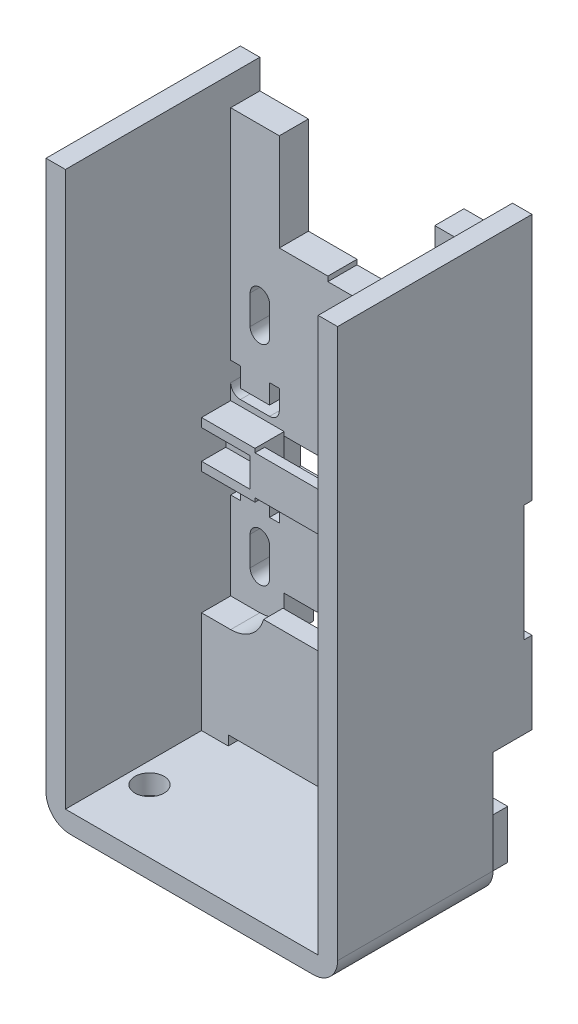
from build123d import *

# Parameters (mm, degrees)
BOSS_EXTRUDE1_DEPTH = 20
CUT_EXTRUDE1_DEPTH  = 39.668462602
CUT_EXTRUDE2_DEPTH  = 39.668462602
SKETCH4_W           = 26
SKETCH4_H           = 57
CUT_EXTRUDE3_DEPTH  = 14
CUT_EXTRUDE4_DEPTH  = 0.8
CUT_EXTRUDE5_DEPTH  = 39.260815464
CUT_EXTRUDE6_DEPTH  = 4
SKETCH8_W           = 5
SKETCH8_H           = 6.5
BOSS_EXTRUDE2_DEPTH = 1
SKETCH9_W           = 20.5
SKETCH9_H           = 1
CUT_EXTRUDE7_DEPTH  = 39.668462602
SKETCH10_W          = 11.5
SKETCH10_H          = 2
CUT_EXTRUDE8_DEPTH  = 1
CUT_EXTRUDE9_DEPTH  = 3
CUT_EXTRUDE10_REACH = 40.668
SKETCH12_W          = 15
SKETCH12_H          = 2
SKETCH13_W          = 16
SKETCH13_H          = 4
CUT_EXTRUDE11_DEPTH = 2.2
SKETCH14_W          = 5
SKETCH14_H          = 3
CUT_EXTRUDE12_DEPTH = 2.5
CUT_EXTRUDE13_REACH = 66.078
SKETCH15_R          = 1.5


with BuildPart() as part:
    # Sketch1 → Boss-Extrude1 (new body)
    with BuildSketch(Plane.XY):
        with BuildLine():
            Line((-15, 29.5), (15, 29.5))
            Line((15, 29.5), (15, -27))
            ThreePointArc((15, -27), (14.267766953, -28.767766953), (12.5, -29.5))
            Line((12.5, -29.5), (-12.5, -29.5))
            ThreePointArc((-12.5, -29.5), (-14.267766953, -28.767766953), (-15, -27))
            Line((-15, -27), (-15, 29.5))
        make_face()
    extrude(amount=BOSS_EXTRUDE1_DEPTH)

    # Sketch2 → Cut-Extrude1 (cut, through all)
    with BuildSketch(Plane(origin=(0, 0, 0), x_dir=(-1, 0, 0), z_dir=(0, 0, -1))):
        Polygon((-13, 29.5), (-13, 26.5), (-8, 26.5), (-8, 16.5), (-3, 16.5), (-3, 16), (3, 16), (3, 16.5), (8, 16.5), (8, 26.5), (13, 26.5), (13, 29.5), align=None)
    extrude(amount=-CUT_EXTRUDE1_DEPTH, mode=Mode.SUBTRACT)

    # Sketch3 → Cut-Extrude2 (cut, through all)
    with BuildSketch(Plane(origin=(0, 0, 0), x_dir=(-1, 0, 0), z_dir=(0, 0, -1))):
        with BuildLine():
            Line((-9, 11), (-9, 8))
            ThreePointArc((-9, 8), (-10, 7), (-11, 8))
            Line((-11, 8), (-11, 11))
            ThreePointArc((-11, 11), (-10, 12), (-9, 11))
        make_face()
        with BuildLine():
            Line((9, 8), (9, 11))
            ThreePointArc((9, 11), (10, 12), (11, 11))
            Line((11, 11), (11, 8))
            ThreePointArc((11, 8), (10, 7), (9, 8))
        make_face()
        with BuildLine():
            Line((9, -13.5), (9, -10.5))
            ThreePointArc((9, -10.5), (10, -9.5), (11, -10.5))
            Line((11, -10.5), (11, -13.5))
            ThreePointArc((11, -13.5), (10, -14.5), (9, -13.5))
        make_face()
        with BuildLine():
            Line((-9, -10.5), (-9, -13.5))
            ThreePointArc((-9, -13.5), (-10, -14.5), (-11, -13.5))
            Line((-11, -13.5), (-11, -10.5))
            ThreePointArc((-11, -10.5), (-10, -9.5), (-9, -10.5))
        make_face()
    extrude(amount=-CUT_EXTRUDE2_DEPTH, mode=Mode.SUBTRACT)

    # Sketch4 → Cut-Extrude3 (cut)
    with BuildSketch(Plane.XY.offset(20)):
        with Locations((0, 1)):
            Rectangle(SKETCH4_W, SKETCH4_H)
    extrude(amount=-CUT_EXTRUDE3_DEPTH, mode=Mode.SUBTRACT)

    # Sketch5 → Cut-Extrude4 (cut)
    with BuildSketch(Plane(origin=(0, 0, 0), x_dir=(-1, 0, 0), z_dir=(0, 0, -1))):
        Polygon((-15, 4), (-12, 4), (-12, 2), (-9, 2), (-9, 4), (9, 4), (9, 2), (12, 2), (12, 4), (15, 4), (15, -8), (12, -8), (12, -6), (9, -6), (9, -8), (5.5, -8), (5.5, -14), (-5.5, -14), (-5.5, -8), (-9, -8), (-9, -6), (-12, -6), (-12, -8), (-15, -8), align=None)
    extrude(amount=-CUT_EXTRUDE4_DEPTH, mode=Mode.SUBTRACT)

    # Sketch6 → Cut-Extrude5 (cut, through all)
    with BuildSketch(Plane(origin=(0, 0, 0.8), x_dir=(-1, 0, 0), z_dir=(0, 0, -1))):
        with BuildLine():
            Line((-12, 4), (-12, 2))
            Line((-12, 2), (-9, 2))
            Line((-9, 2), (-9, 4))
            Line((-9, 4), (-8, 4))
            Line((-8, 4), (-8, 2))
            ThreePointArc((-8, 2), (-8.292893219, 1.292893219), (-9, 1))
            Line((-9, 1), (-12, 1))
            ThreePointArc((-12, 1), (-12.707106781, 1.292893219), (-13, 2))
            Line((-13, 2), (-13, 4))
            Line((-13, 4), (-12, 4))
        make_face()
        with BuildLine():
            Line((13, 4), (12, 4))
            Line((12, 4), (12, 2))
            Line((12, 2), (9, 2))
            Line((9, 2), (9, 4))
            Line((9, 4), (8, 4))
            Line((8, 4), (8, 2))
            ThreePointArc((8, 2), (8.292893219, 1.292893219), (9, 1))
            Line((9, 1), (12, 1))
            ThreePointArc((12, 1), (12.707106781, 1.292893219), (13, 2))
            Line((13, 2), (13, 4))
        make_face()
        with BuildLine():
            Line((12, -8), (12, -6))
            Line((12, -6), (9, -6))
            Line((9, -6), (9, -8))
            Line((9, -8), (8, -8))
            Line((8, -8), (8, -6))
            ThreePointArc((8, -6), (8.292893219, -5.292893219), (9, -5))
            Line((9, -5), (12, -5))
            ThreePointArc((12, -5), (12.707106781, -5.292893219), (13, -6))
            Line((13, -6), (13, -8))
            Line((13, -8), (12, -8))
        make_face()
        with BuildLine():
            Line((-13, -8), (-12, -8))
            Line((-12, -8), (-12, -6))
            Line((-12, -6), (-9, -6))
            Line((-9, -6), (-9, -8))
            Line((-9, -8), (-8, -8))
            Line((-8, -8), (-8, -6))
            ThreePointArc((-8, -6), (-8.292893219, -5.292893219), (-9, -5))
            Line((-9, -5), (-12, -5))
            ThreePointArc((-12, -5), (-12.707106781, -5.292893219), (-13, -6))
            Line((-13, -6), (-13, -8))
        make_face()
    extrude(amount=-CUT_EXTRUDE5_DEPTH, mode=Mode.SUBTRACT)

    # Sketch7 → Cut-Extrude6 (cut)
    with BuildSketch(Plane(origin=(0, 0, 0), x_dir=(-1, 0, 0), z_dir=(0, 0, -1))):
        with BuildLine():
            Line((-7.5, -14), (7.5, -14))
            Line((7.5, -14), (7.5, -18))
            Line((7.5, -18), (10.828862426, -19.921919618))
            Line((10.828862426, -19.921919618), (15, -16.421919618))
            Line((15, -16.421919618), (15, -27))
            ThreePointArc((15, -27), (14.267766953, -28.767766953), (12.5, -29.5))
            Line((12.5, -29.5), (12.5, -24.5))
            Line((12.5, -24.5), (-12.5, -24.5))
            Line((-12.5, -24.5), (-12.5, -29.5))
            ThreePointArc((-12.5, -29.5), (-14.267766953, -28.767766953), (-15, -27))
            Line((-15, -27), (-15, -16.421919618))
            Line((-15, -16.421919618), (-10.828862426, -19.921919618))
            Line((-10.828862426, -19.921919618), (-7.5, -18))
            Line((-7.5, -18), (-7.5, -14))
        make_face()
    extrude(amount=-CUT_EXTRUDE6_DEPTH, mode=Mode.SUBTRACT)

    # Sketch8 → Boss-Extrude2 (add)
    with BuildSketch(Plane(origin=(0, 0, 4), x_dir=(-1, 0, 0), z_dir=(0, 0, -1))):
        with Locations((-10, -21.25)):
            Rectangle(SKETCH8_W, SKETCH8_H)
        with Locations((10, -21.25)):
            Rectangle(SKETCH8_W, SKETCH8_H)
    extrude(amount=BOSS_EXTRUDE2_DEPTH)

    # Sketch9 → Cut-Extrude7 (cut, through all)
    with BuildSketch(Plane(origin=(0, 0, 0), x_dir=(-1, 0, 0), z_dir=(0, 0, -1))):
        with Locations((0, -27)):
            Rectangle(SKETCH9_W, SKETCH9_H)
    extrude(amount=-CUT_EXTRUDE7_DEPTH, mode=Mode.SUBTRACT)

    # Sketch10 → Cut-Extrude8 (cut)
    with BuildSketch(Plane(origin=(0, 0, 0), x_dir=(-1, 0, 0), z_dir=(0, 0, -1))):
        with Locations((0, -25.5)):
            Rectangle(SKETCH10_W, SKETCH10_H)
    extrude(amount=-CUT_EXTRUDE8_DEPTH, mode=Mode.SUBTRACT)

    # Sketch11 → Cut-Extrude9 (cut)
    with BuildSketch(Plane.XY.offset(6)):
        Polygon((-13, 26.5), (-13, 0.4), (-7.5, 0.4), (-7.5, 0), (7.5, 0), (7.5, 0.4), (13, 0.4), (13, 26.5), align=None)
        with BuildLine():
            Line((7.5, -4.4), (13, -4.4))
            Line((13, -4.4), (13, -17))
            Line((13, -17), (10, -17))
            ThreePointArc((10, -17), (7.869334998, -16.276736691), (6.619259608, -14.405866658))
            Line((6.619259608, -14.405866658), (-6.619259608, -14.405866658))
            ThreePointArc((-6.619259608, -14.405866658), (-7.869334998, -16.276736691), (-10, -17))
            Line((-10, -17), (-13, -17))
            Line((-13, -17), (-13, -4.4))
            Line((-13, -4.4), (-7.5, -4.4))
            Line((-7.5, -4.4), (-7.5, -4))
            Line((-7.5, -4), (7.5, -4))
            Line((7.5, -4), (7.5, -4.4))
        make_face()
    extrude(amount=-CUT_EXTRUDE9_DEPTH, mode=Mode.SUBTRACT)

    # Sketch12 → Cut-Extrude10 (cut, up to next)
    with BuildSketch(Plane(origin=(0, 0, 0), x_dir=(1, 0, 0), z_dir=(0, 1, 0)), mode=Mode.PRIVATE) as cut_extrude10_sk1:
        with Locations((0, -4)):
            Rectangle(SKETCH12_W, SKETCH12_H)
    cut_extrude10_tool1 = extrude(cut_extrude10_sk1.sketch, amount=-CUT_EXTRUDE10_REACH, mode=Mode.PRIVATE) & part.part
    add(cut_extrude10_tool1.solids().sort_by_distance((0, 0, 4))[0], mode=Mode.SUBTRACT)

    # Sketch13 → Cut-Extrude11 (cut)
    with BuildSketch(Plane(origin=(0, 0, 0.8), x_dir=(-1, 0, 0), z_dir=(0, 0, -1))):
        with Locations((0, -2)):
            Rectangle(SKETCH13_W, SKETCH13_H)
    extrude(amount=-CUT_EXTRUDE11_DEPTH, mode=Mode.SUBTRACT)

    # Sketch14 → Cut-Extrude12 (cut)
    with BuildSketch(Plane.XY.offset(6)):
        with Locations((-10.5, -2)):
            Rectangle(SKETCH14_W, SKETCH14_H)
        with Locations((10.5, -2)):
            Rectangle(SKETCH14_W, SKETCH14_H)
    extrude(amount=-CUT_EXTRUDE12_DEPTH, mode=Mode.SUBTRACT)

    # Sketch15 → Cut-Extrude13 (cut, up to next)
    with BuildSketch(Plane.XZ.offset(29.5), mode=Mode.PRIVATE) as cut_extrude13_sk1:
        with Locations(Location((-10.85, 13.5, 0), (0, 0, 270))):
            Circle(SKETCH15_R)
    cut_extrude13_tool1 = extrude(cut_extrude13_sk1.sketch, amount=-CUT_EXTRUDE13_REACH, mode=Mode.PRIVATE) & part.part
    # Sketch15 → Cut-Extrude13 (cut, up to next)
    with BuildSketch(Plane.XZ.offset(29.5), mode=Mode.PRIVATE) as cut_extrude13_sk2:
        with Locations(Location((10.85, 13.5, 0), (0, 0, 270))):
            Circle(SKETCH15_R)
    cut_extrude13_tool2 = extrude(cut_extrude13_sk2.sketch, amount=-CUT_EXTRUDE13_REACH, mode=Mode.PRIVATE) & part.part
    add(cut_extrude13_tool1.solids().sort_by_distance((-10.85, -29.5, 13.5))[0], mode=Mode.SUBTRACT)
    add(cut_extrude13_tool2.solids().sort_by_distance((10.85, -29.5, 13.5))[0], mode=Mode.SUBTRACT)


solid = part.part
